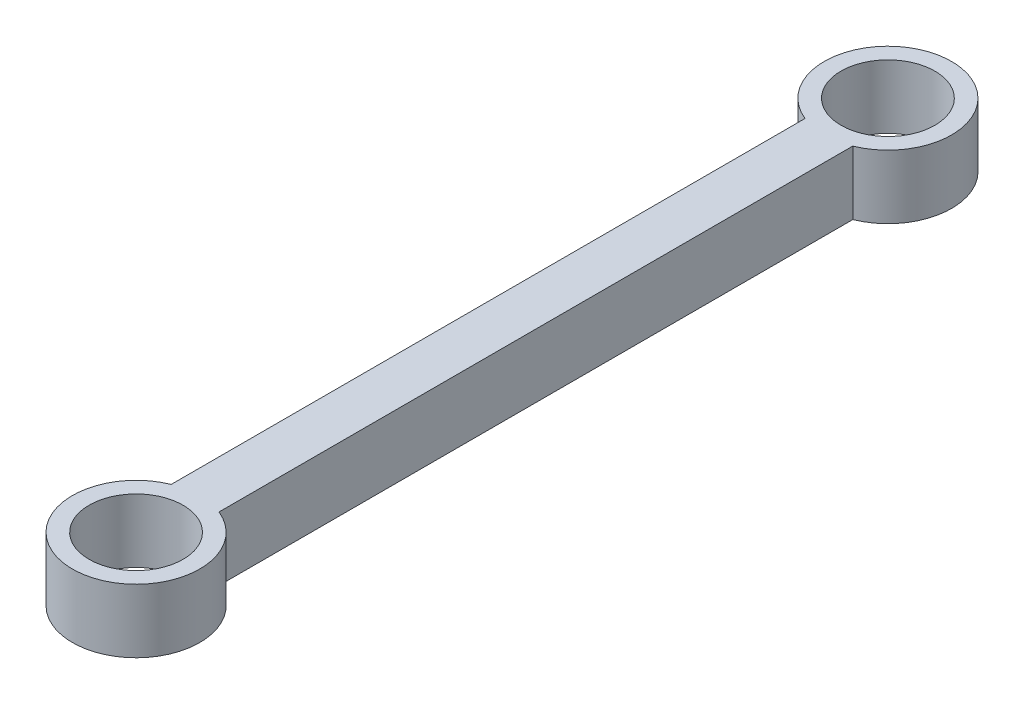
from build123d import *

# Parameters (mm, degrees)
SKETCH1_R           = 2.95
BOSS_EXTRUDE1_DEPTH = 4


with BuildPart() as part:
    # Sketch1 → Boss-Extrude1 (new body)
    with BuildSketch(Plane(origin=(0, 0, 0), x_dir=(1, 0, 0), z_dir=(0, 1, 0))):
        with BuildLine():
            Line((-1.5, 43.511900756), (-1.5, 3.708099244))
            ThreePointArc((-1.5, 3.708099244), (0, -4), (1.5, 3.708099244))
            Line((1.5, 3.708099244), (1.5, 43.511900756))
            ThreePointArc((1.5, 43.511900756), (0, 51.22), (-1.5, 43.511900756))
        make_face()
        with Locations(Location((0, 47.22, 0), (0, 0, 270))):
            Circle(SKETCH1_R, mode=Mode.SUBTRACT)
        with Locations(Location((0, 0, 0), (0, 0, 270))):
            Circle(SKETCH1_R, mode=Mode.SUBTRACT)
    extrude(amount=BOSS_EXTRUDE1_DEPTH)


solid = part.part
